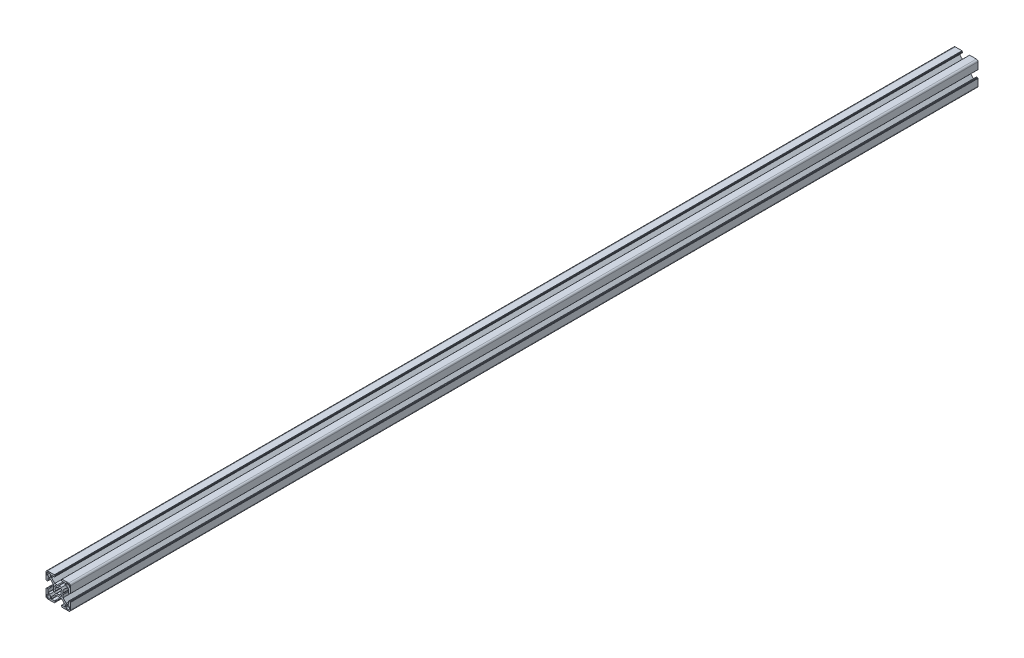
from build123d import *

# Parameters (mm, degrees)
DODANIE_WYCI_GNI_CIE1_DEPTH = 1120


with BuildPart() as part:
    # Szkic1 → Dodanie-wyciągnięcie1 (new body)
    with BuildSketch(Plane.XY):
        with BuildLine():
            Line((96.56, 29.575148163), (97.459999946, 29.06))
            Line((97.459999946, 29.06), (100.764466193, 29.06))
            Line((100.764466193, 29.06), (104.810000327, 25.010000763))
            Line((104.810000327, 25.010000763), (104.810000327, 22.460001166))
            ThreePointArc((104.810000327, 22.460001166), (104.751421565, 22.318579525), (104.609999924, 22.260000763))
            Line((104.609999924, 22.260000763), (101.210000197, 22.260000763))
            ThreePointArc((101.210000197, 22.260000763), (100.785735989, 22.084264774), (100.61, 21.660000566))
            Line((100.61, 21.660000566), (100.61, 20.760000374))
            ThreePointArc((100.61, 20.760000374), (100.668578753, 20.618578753), (100.810000374, 20.56))
            Line((100.810000374, 20.56), (100.910000144, 20.56))
            ThreePointArc((100.910000144, 20.56), (101.05142109, 20.501421526), (101.109999564, 20.36000058))
            Line((101.109999564, 20.36000058), (101.109999564, 20.260000381))
            ThreePointArc((101.109999564, 20.260000381), (101.16857832, 20.118578755), (101.309999945, 20.06))
            Line((101.309999945, 20.06), (109.560000346, 20.06))
            ThreePointArc((109.560000346, 20.06), (110.974213664, 20.645786336), (111.56, 22.059999654))
            Line((111.56, 22.059999654), (111.56, 30.310000479))
            ThreePointArc((111.56, 30.310000479), (111.501421273, 30.451422036), (111.359999716, 30.510000763))
            Line((111.359999716, 30.510000763), (111.260000611, 30.510000763))
            ThreePointArc((111.260000611, 30.510000763), (111.118579054, 30.56857949), (111.060000327, 30.710001047))
            Line((111.060000327, 30.710001047), (111.060000327, 30.810000479))
            ThreePointArc((111.060000327, 30.810000479), (111.0014216, 30.951422036), (110.860000043, 31.010000763))
            Line((110.860000043, 31.010000763), (109.95999994, 31.010000763))
            ThreePointArc((109.95999994, 31.010000763), (109.535735606, 30.834264722), (109.359999564, 30.410000387))
            Line((109.359999564, 30.410000387), (109.359999564, 27.010000284))
            ThreePointArc((109.359999564, 27.010000284), (109.301420837, 26.868578727), (109.15999928, 26.81))
            Line((109.15999928, 26.81), (106.609999564, 26.81))
            Line((106.609999564, 26.81), (102.56446543, 30.855534134))
            Line((102.56446543, 30.855534134), (102.56446543, 34.160000381))
            Line((102.56446543, 34.160000381), (102.044852164, 35.06))
            Line((102.044852164, 35.06), (102.56446543, 35.959999619))
            Line((102.56446543, 35.959999619), (102.56446543, 39.264465866))
            Line((102.56446543, 39.264465866), (106.609999564, 43.31))
            Line((106.609999564, 43.31), (109.15999928, 43.31))
            ThreePointArc((109.15999928, 43.31), (109.301420837, 43.251421273), (109.359999564, 43.109999716))
            Line((109.359999564, 43.109999716), (109.359999564, 39.709999613))
            ThreePointArc((109.359999564, 39.709999613), (109.535735606, 39.285735278), (109.95999994, 39.109999237))
            Line((109.95999994, 39.109999237), (110.860000043, 39.109999237))
            ThreePointArc((110.860000043, 39.109999237), (111.0014216, 39.168577964), (111.060000327, 39.309999521))
            Line((111.060000327, 39.309999521), (111.060000327, 39.409998953))
            ThreePointArc((111.060000327, 39.409998953), (111.118579054, 39.55142051), (111.260000611, 39.609999237))
            Line((111.260000611, 39.609999237), (111.359999716, 39.609999237))
            ThreePointArc((111.359999716, 39.609999237), (111.501421273, 39.668577964), (111.56, 39.809999521))
            Line((111.56, 39.809999521), (111.56, 48.060000346))
            ThreePointArc((111.56, 48.060000346), (110.974213664, 49.474213664), (109.560000346, 50.06))
            Line((109.560000346, 50.06), (101.309999945, 50.06))
            ThreePointArc((101.309999945, 50.06), (101.16857832, 50.001421245), (101.109999564, 49.859999619))
            Line((101.109999564, 49.859999619), (101.109999564, 49.75999942))
            ThreePointArc((101.109999564, 49.75999942), (101.05142109, 49.618578474), (100.910000144, 49.56))
            Line((100.910000144, 49.56), (100.810000374, 49.56))
            ThreePointArc((100.810000374, 49.56), (100.668578753, 49.501421247), (100.61, 49.359999626))
            Line((100.61, 49.359999626), (100.61, 48.459999434))
            ThreePointArc((100.61, 48.459999434), (100.785735989, 48.035735226), (101.210000197, 47.859999237))
            Line((101.210000197, 47.859999237), (104.609999924, 47.859999237))
            ThreePointArc((104.609999924, 47.859999237), (104.751421565, 47.801420475), (104.810000327, 47.659998834))
            Line((104.810000327, 47.659998834), (104.810000327, 45.109999237))
            Line((104.810000327, 45.109999237), (100.764466193, 41.06))
            Line((100.764466193, 41.06), (97.459999946, 41.06))
            Line((97.459999946, 41.06), (96.56, 40.544851837))
            Line((96.56, 40.544851837), (95.660000054, 41.06))
            Line((95.660000054, 41.06), (92.355533807, 41.06))
            Line((92.355533807, 41.06), (88.309999673, 45.109999237))
            Line((88.309999673, 45.109999237), (88.309999673, 47.659998834))
            ThreePointArc((88.309999673, 47.659998834), (88.368578435, 47.801420475), (88.510000076, 47.859999237))
            Line((88.510000076, 47.859999237), (91.909999803, 47.859999237))
            ThreePointArc((91.909999803, 47.859999237), (92.334264011, 48.035735226), (92.51, 48.459999434))
            Line((92.51, 48.459999434), (92.51, 49.359999626))
            ThreePointArc((92.51, 49.359999626), (92.451421247, 49.501421247), (92.309999626, 49.56))
            Line((92.309999626, 49.56), (92.209999856, 49.56))
            ThreePointArc((92.209999856, 49.56), (92.06857891, 49.618578474), (92.010000436, 49.75999942))
            Line((92.010000436, 49.75999942), (92.010000436, 49.859999619))
            ThreePointArc((92.010000436, 49.859999619), (91.95142168, 50.001421245), (91.810000055, 50.06))
            Line((91.810000055, 50.06), (83.559999654, 50.06))
            ThreePointArc((83.559999654, 50.06), (82.145786336, 49.474213664), (81.56, 48.060000346))
            Line((81.56, 48.060000346), (81.56, 39.809999521))
            ThreePointArc((81.56, 39.809999521), (81.618578727, 39.668577964), (81.760000284, 39.609999237))
            Line((81.760000284, 39.609999237), (81.859999389, 39.609999237))
            ThreePointArc((81.859999389, 39.609999237), (82.001420946, 39.55142051), (82.059999673, 39.409998953))
            Line((82.059999673, 39.409998953), (82.059999673, 39.309999521))
            ThreePointArc((82.059999673, 39.309999521), (82.1185784, 39.168577964), (82.259999957, 39.109999237))
            Line((82.259999957, 39.109999237), (83.16000006, 39.109999237))
            ThreePointArc((83.16000006, 39.109999237), (83.584264394, 39.285735278), (83.760000436, 39.709999613))
            Line((83.760000436, 39.709999613), (83.760000436, 43.109999716))
            ThreePointArc((83.760000436, 43.109999716), (83.818579163, 43.251421273), (83.96000072, 43.31))
            Line((83.96000072, 43.31), (86.510000436, 43.31))
            Line((86.510000436, 43.31), (90.55553457, 39.264465866))
            Line((90.55553457, 39.264465866), (90.55553457, 35.959999619))
            Line((90.55553457, 35.959999619), (91.075147836, 35.06))
            Line((91.075147836, 35.06), (90.55553457, 34.160000381))
            Line((90.55553457, 34.160000381), (90.55553457, 30.855534134))
            Line((90.55553457, 30.855534134), (86.510000436, 26.81))
            Line((86.510000436, 26.81), (83.96000072, 26.81))
            ThreePointArc((83.96000072, 26.81), (83.818579163, 26.868578727), (83.760000436, 27.010000284))
            Line((83.760000436, 27.010000284), (83.760000436, 30.410000387))
            ThreePointArc((83.760000436, 30.410000387), (83.584264394, 30.834264722), (83.16000006, 31.010000763))
            Line((83.16000006, 31.010000763), (82.259999957, 31.010000763))
            ThreePointArc((82.259999957, 31.010000763), (82.1185784, 30.951422036), (82.059999673, 30.810000479))
            Line((82.059999673, 30.810000479), (82.059999673, 30.710001047))
            ThreePointArc((82.059999673, 30.710001047), (82.001420946, 30.56857949), (81.859999389, 30.510000763))
            Line((81.859999389, 30.510000763), (81.760000284, 30.510000763))
            ThreePointArc((81.760000284, 30.510000763), (81.618578727, 30.451422036), (81.56, 30.310000479))
            Line((81.56, 30.310000479), (81.56, 22.059999654))
            ThreePointArc((81.56, 22.059999654), (82.145786336, 20.645786336), (83.559999654, 20.06))
            Line((83.559999654, 20.06), (91.810000055, 20.06))
            ThreePointArc((91.810000055, 20.06), (91.95142168, 20.118578755), (92.010000436, 20.260000381))
            Line((92.010000436, 20.260000381), (92.010000436, 20.36000058))
            ThreePointArc((92.010000436, 20.36000058), (92.06857891, 20.501421526), (92.209999856, 20.56))
            Line((92.209999856, 20.56), (92.309999626, 20.56))
            ThreePointArc((92.309999626, 20.56), (92.451421247, 20.618578753), (92.51, 20.760000374))
            Line((92.51, 20.760000374), (92.51, 21.660000566))
            ThreePointArc((92.51, 21.660000566), (92.334264011, 22.084264774), (91.909999803, 22.260000763))
            Line((91.909999803, 22.260000763), (88.510000076, 22.260000763))
            ThreePointArc((88.510000076, 22.260000763), (88.368578435, 22.318579525), (88.309999673, 22.460001166))
            Line((88.309999673, 22.460001166), (88.309999673, 25.010000763))
            Line((88.309999673, 25.010000763), (92.355533807, 29.06))
            Line((92.355533807, 29.06), (95.660000054, 29.06))
            Line((95.660000054, 29.06), (96.56, 29.575148163))
        make_face()
        with BuildLine():
            Line((109.26000109, 48.760000398), (107.060000327, 48.760000398))
            ThreePointArc((107.060000327, 48.760000398), (106.352893543, 48.467107182), (106.060000327, 47.760000398))
            Line((106.060000327, 47.760000398), (106.060000327, 45.559999635))
            ThreePointArc((106.060000327, 45.559999635), (106.352893543, 44.852892851), (107.060000327, 44.559999635))
            Line((107.060000327, 44.559999635), (109.26000109, 44.559999635))
            ThreePointArc((109.26000109, 44.559999635), (109.967107874, 44.852892851), (110.26000109, 45.559999635))
            Line((110.26000109, 45.559999635), (110.26000109, 47.760000398))
            ThreePointArc((110.26000109, 47.760000398), (109.967107874, 48.467107182), (109.26000109, 48.760000398))
        make_face(mode=Mode.SUBTRACT)
        with BuildLine():
            Line((94.959870476, 38.340561767), (93.424070588, 39.578400903))
            ThreePointArc((93.424070588, 39.578400903), (92.678997741, 38.957155561), (92.054663108, 38.214669473))
            Line((92.054663108, 38.214669473), (93.279438268, 36.660129597))
            ThreePointArc((93.279438268, 36.660129597), (92.91, 35.06), (93.279438268, 33.459870403))
            Line((93.279438268, 33.459870403), (92.054663108, 31.905330527))
            ThreePointArc((92.054663108, 31.905330527), (92.678997741, 31.162844439), (93.424070588, 30.541599097))
            Line((93.424070588, 30.541599097), (94.959870476, 31.779438233))
            ThreePointArc((94.959870476, 31.779438233), (96.56, 31.41), (98.160129524, 31.779438233))
            Line((98.160129524, 31.779438233), (99.695929412, 30.541599097))
            ThreePointArc((99.695929412, 30.541599097), (100.441002259, 31.162844439), (101.065336892, 31.905330527))
            Line((101.065336892, 31.905330527), (99.840561732, 33.459870403))
            ThreePointArc((99.840561732, 33.459870403), (100.21, 35.06), (99.840561732, 36.660129597))
            Line((99.840561732, 36.660129597), (101.065336892, 38.214669473))
            ThreePointArc((101.065336892, 38.214669473), (100.441002259, 38.957155561), (99.695929412, 39.578400903))
            Line((99.695929412, 39.578400903), (98.160129524, 38.340561767))
            ThreePointArc((98.160129524, 38.340561767), (96.56, 38.71), (94.959870476, 38.340561767))
        make_face(mode=Mode.SUBTRACT)
        with BuildLine():
            Line((83.85999891, 21.359999602), (86.059999673, 21.359999602))
            ThreePointArc((86.059999673, 21.359999602), (86.767106457, 21.652892818), (87.059999673, 22.359999602))
            Line((87.059999673, 22.359999602), (87.059999673, 24.560000365))
            ThreePointArc((87.059999673, 24.560000365), (86.767106457, 25.267107149), (86.059999673, 25.560000365))
            Line((86.059999673, 25.560000365), (83.85999891, 25.560000365))
            ThreePointArc((83.85999891, 25.560000365), (83.152892126, 25.267107149), (82.85999891, 24.560000365))
            Line((82.85999891, 24.560000365), (82.85999891, 22.359999602))
            ThreePointArc((82.85999891, 22.359999602), (83.152892126, 21.652892818), (83.85999891, 21.359999602))
        make_face(mode=Mode.SUBTRACT)
        with BuildLine():
            Line((110.26000109, 22.359999602), (110.26000109, 24.560000365))
            ThreePointArc((110.26000109, 24.560000365), (109.967107874, 25.267107149), (109.26000109, 25.560000365))
            Line((109.26000109, 25.560000365), (107.060000327, 25.560000365))
            ThreePointArc((107.060000327, 25.560000365), (106.352893543, 25.267107149), (106.060000327, 24.560000365))
            Line((106.060000327, 24.560000365), (106.060000327, 22.359999602))
            ThreePointArc((106.060000327, 22.359999602), (106.352893543, 21.652892818), (107.060000327, 21.359999602))
            Line((107.060000327, 21.359999602), (109.26000109, 21.359999602))
            ThreePointArc((109.26000109, 21.359999602), (109.967107874, 21.652892818), (110.26000109, 22.359999602))
        make_face(mode=Mode.SUBTRACT)
        with BuildLine():
            Line((86.059999673, 48.760000398), (83.85999891, 48.760000398))
            ThreePointArc((83.85999891, 48.760000398), (83.152892126, 48.467107182), (82.85999891, 47.760000398))
            Line((82.85999891, 47.760000398), (82.85999891, 45.559999635))
            ThreePointArc((82.85999891, 45.559999635), (83.152892126, 44.852892851), (83.85999891, 44.559999635))
            Line((83.85999891, 44.559999635), (86.059999673, 44.559999635))
            ThreePointArc((86.059999673, 44.559999635), (86.767106457, 44.852892851), (87.059999673, 45.559999635))
            Line((87.059999673, 45.559999635), (87.059999673, 47.760000398))
            ThreePointArc((87.059999673, 47.760000398), (86.767106457, 48.467107182), (86.059999673, 48.760000398))
        make_face(mode=Mode.SUBTRACT)
    extrude(amount=DODANIE_WYCI_GNI_CIE1_DEPTH)


solid = part.part
